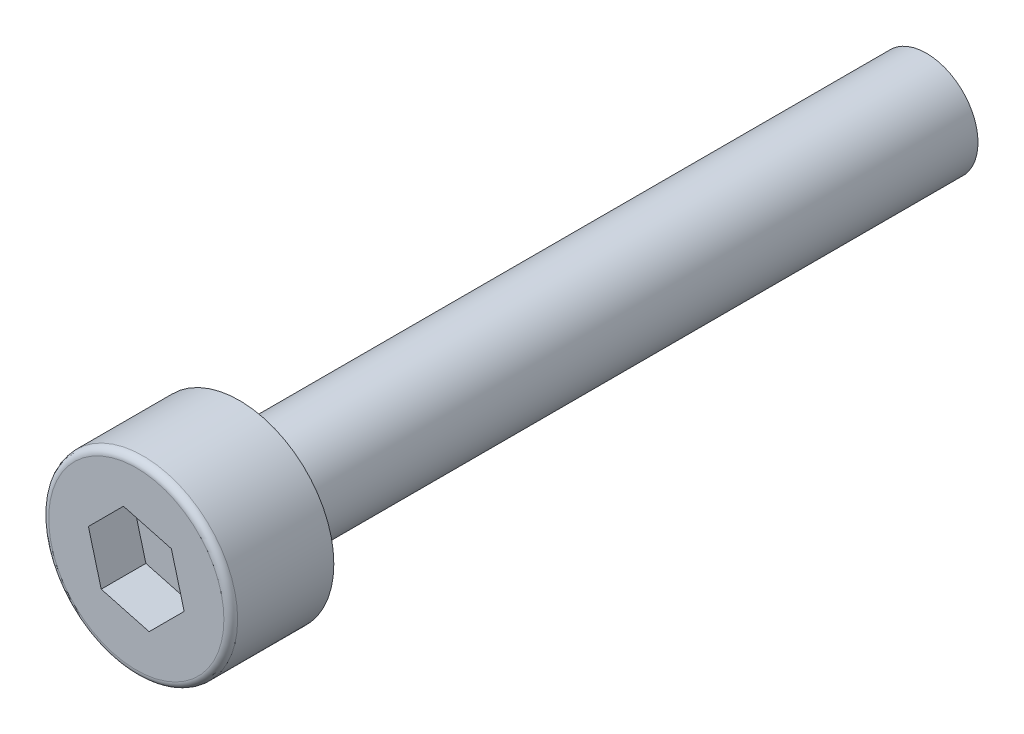
from build123d import *

# Parameters (mm, degrees)
SKETCH_1_R          = 2.75
EXTRUDE_1_DEPTH     = 3
CUT_EXTRUDE_1_DEPTH = 1.3
SKETCH_3_R          = 1.5
EXTRUDE_2_DEPTH     = 20
FILLET_1_R          = 0.2


with BuildPart() as part:
    # 草图1 → 凸台-拉伸1 (new body)
    with BuildSketch(Plane.XY):
        Circle(SKETCH_1_R)
    extrude(amount=EXTRUDE_1_DEPTH)

    # 草图2 → 切除-拉伸1 (cut)
    with BuildSketch(Plane.XY.offset(3)):
        Polygon((-1.020620726, -1.020620726), (0.373573113, -1.39419384), (1.39419384, -0.373573113), (1.020620726, 1.020620726), (-0.373573113, 1.39419384), (-1.39419384, 0.373573113), align=None)
    extrude(amount=-CUT_EXTRUDE_1_DEPTH, mode=Mode.SUBTRACT)

    # 草图3 → 凸台-拉伸2 (add)
    with BuildSketch(Plane(origin=(0, 0, 0), x_dir=(-1, 0, 0), z_dir=(0, 0, -1))):
        with Locations(Location((0, 0, 0), (0, 0, 180))):
            Circle(SKETCH_3_R)
    extrude(amount=EXTRUDE_2_DEPTH)

    # 圆角1
    fillet_1_edges = [part.edges().sort_by_distance(p)[0] for p in [
        (-2.75, 0, 3),
    ]]
    fillet(fillet_1_edges, radius=FILLET_1_R)


solid = part.part
